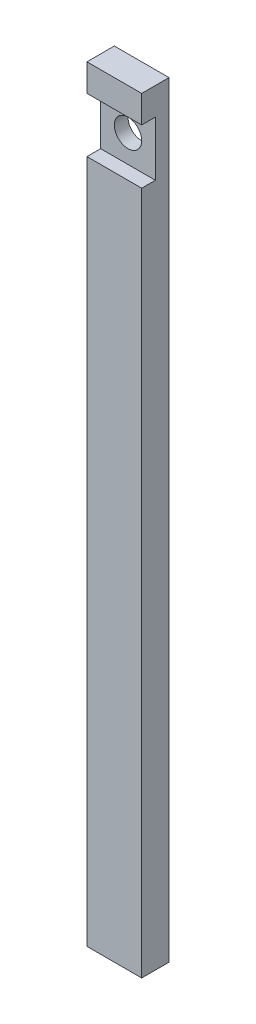
from build123d import *

# Parameters (mm, degrees)
SKETCH1_W           = 25.4
SKETCH1_H           = 12.7
BOSS_EXTRUDE1_DEPTH = 355.6
SKETCH2_W           = 6.35
SKETCH2_H           = 25.4
CUT_EXTRUDE1_DEPTH  = 357.732126392
SKETCH3_R           = 6.35
CUT_EXTRUDE2_DEPTH  = 357.562536591
SKETCH4_R           = 3.175
CUT_EXTRUDE3_DEPTH  = 25.4


with BuildPart() as part:
    # Sketch1 → Boss-Extrude1 (new body)
    with BuildSketch(Plane(origin=(0, 0, 0), x_dir=(1, 0, 0), z_dir=(0, 1, 0))):
        with Locations((12.7, 6.35)):
            Rectangle(SKETCH1_W, SKETCH1_H)
    extrude(amount=BOSS_EXTRUDE1_DEPTH)

    # Sketch2 → Cut-Extrude1 (cut, through all)
    with BuildSketch(Plane(origin=(25.4, 0, 0), x_dir=(0, 0, -1), z_dir=(1, 0, 0))):
        with Locations((3.175, 330.2)):
            Rectangle(SKETCH2_W, SKETCH2_H)
    extrude(amount=-CUT_EXTRUDE1_DEPTH, mode=Mode.SUBTRACT)

    # Sketch3 → Cut-Extrude2 (cut, through all)
    with BuildSketch(Plane.XY.offset(-6.35)):
        with Locations((12.7, 330.2)):
            Circle(SKETCH3_R)
    extrude(amount=-CUT_EXTRUDE2_DEPTH, mode=Mode.SUBTRACT)

    # Sketch4 → Cut-Extrude3 (cut)
    with BuildSketch(Plane.XZ):
        with Locations(Location((6.35, -6.35, 0), (0, 0, 270))):
            Circle(SKETCH4_R)
        with Locations(Location((19.05, -6.35, 0), (0, 0, 270))):
            Circle(SKETCH4_R)
    extrude(amount=-CUT_EXTRUDE3_DEPTH, mode=Mode.SUBTRACT)


solid = part.part
